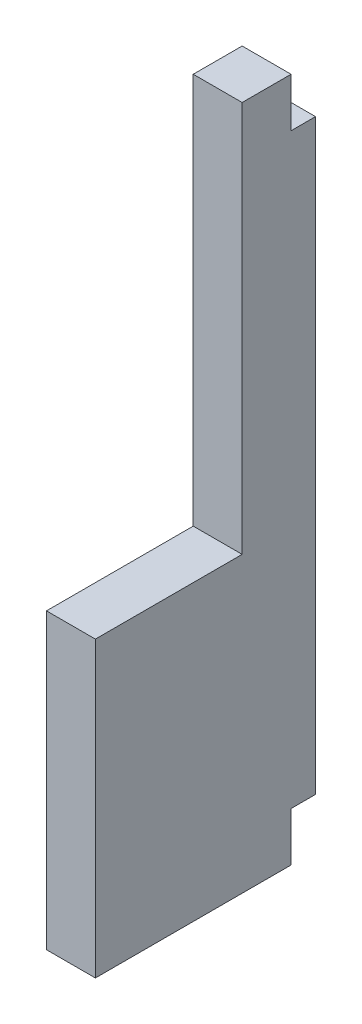
from build123d import *

# Parameters (mm, degrees)
BOSS_EXTRUDE1_DEPTH = 10


with BuildPart() as part:
    # Sketch2 → Boss-Extrude1 (new body)
    with BuildSketch(Plane(origin=(0, 0, 0), x_dir=(0, 0, -1), z_dir=(1, 0, 0))):
        Polygon((0, 0), (0, 80), (10, 80), (10, 70), (15, 70), (15, -50), (10, -50), (10, -60), (-30, -60), (-30, 0), align=None)
    extrude(amount=BOSS_EXTRUDE1_DEPTH)


solid = part.part
